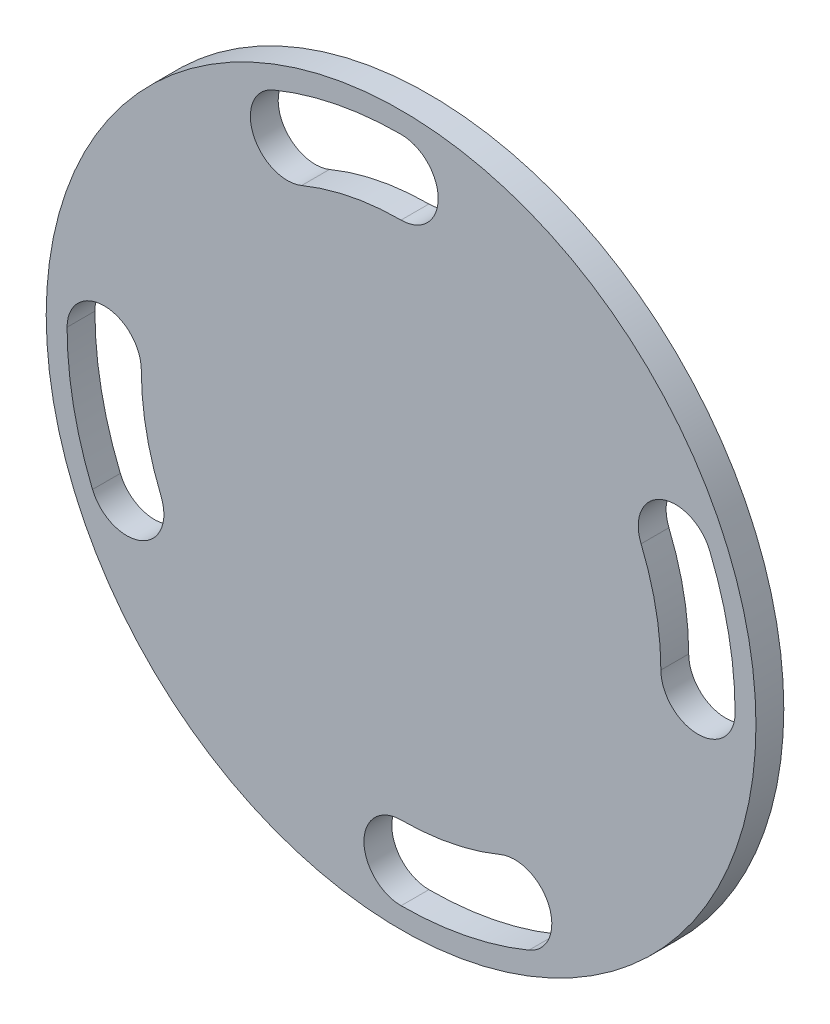
from build123d import *

# Parameters (mm, degrees)
SKETCH1_R           = 7.65
BOSS_EXTRUDE1_DEPTH = 0.6


with BuildPart() as part:
    # Sketch1 → Boss-Extrude1 (new body)
    with BuildSketch(Plane.XY):
        Circle(SKETCH1_R)
        with BuildLine():
            ThreePointArc((0, 5.6), (0.8, 6.4), (0, 7.2))
            ThreePointArc((0, 7.2), (-1.404650319, 7.061654019), (-2.755320713, 6.651932634))
            ThreePointArc((-2.755320713, 6.651932634), (-3.188277593, 5.606682262), (-2.143027221, 5.173725382))
            ThreePointArc((-2.143027221, 5.173725382), (-1.092505803, 5.49239757), (0, 5.6))
        make_face(mode=Mode.SUBTRACT)
        with BuildLine():
            ThreePointArc((6.651932634, 2.755320713), (5.606682262, 3.188277593), (5.173725382, 2.143027221))
            ThreePointArc((5.173725382, 2.143027221), (5.49239757, 1.092505803), (5.6, 0))
            ThreePointArc((5.6, 0), (6.4, -0.8), (7.2, 0))
            ThreePointArc((7.2, 0), (7.061654019, 1.404650319), (6.651932634, 2.755320713))
        make_face(mode=Mode.SUBTRACT)
        with BuildLine():
            ThreePointArc((2.755320713, -6.651932634), (3.188277593, -5.606682262), (2.143027221, -5.173725382))
            ThreePointArc((2.143027221, -5.173725382), (1.092505803, -5.49239757), (0, -5.6))
            ThreePointArc((0, -5.6), (-0.8, -6.4), (0, -7.2))
            ThreePointArc((0, -7.2), (1.404650319, -7.061654019), (2.755320713, -6.651932634))
        make_face(mode=Mode.SUBTRACT)
        with BuildLine():
            ThreePointArc((-6.651932634, -2.755320713), (-5.606682262, -3.188277593), (-5.173725382, -2.143027221))
            ThreePointArc((-5.173725382, -2.143027221), (-5.49239757, -1.092505803), (-5.6, 0))
            ThreePointArc((-5.6, 0), (-6.4, 0.8), (-7.2, 0))
            ThreePointArc((-7.2, 0), (-7.061654019, -1.404650319), (-6.651932634, -2.755320713))
        make_face(mode=Mode.SUBTRACT)
    extrude(amount=BOSS_EXTRUDE1_DEPTH)


solid = part.part
